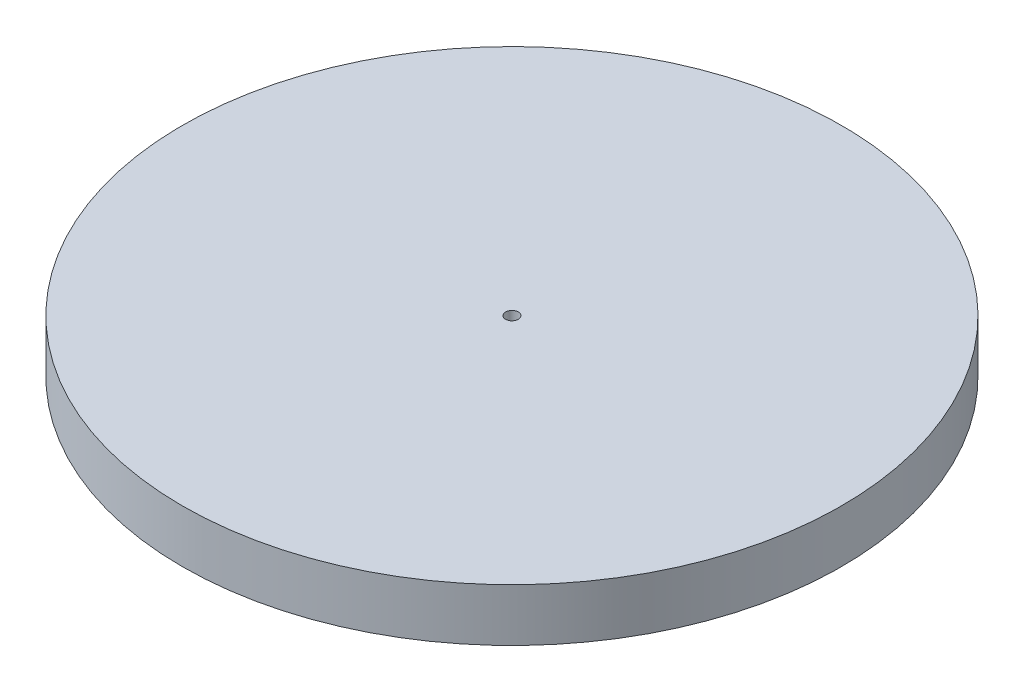
from build123d import *

# Parameters (mm, degrees)
SKETCH5_R          = 1.2
CUT_EXTRUDE1_DEPTH = 97.374391836


with BuildPart() as part:
    # Sketch3 → Revolve4 (revolve)
    with BuildSketch(Plane.XY, mode=Mode.PRIVATE) as revolve4_sk:
        with BuildLine():
            Line((1.2, 40), (1.2, 35))
            Line((1.2, 35), (0, 35))
            Line((0, 35), (0, 0))
            add(Edge.make_bspline(
                [(0, 0), (0.016019319, -0.000318055), (0.047363957, -0.000435511), (0.124565155, 0.000266609), (0.188009448, 0.004784889), (0.302162397, 0.014312965), (0.434906427, 0.033705318), (0.591621889, 0.064644454), (0.758367433, 0.108988084), (0.948542262, 0.167874068), (1.148421918, 0.240807637), (1.371995113, 0.333716386), (1.616332852, 0.447951628), (1.849490673, 0.566207637), (2.087888718, 0.695473704), (2.332059128, 0.835246826), (2.58184161, 0.985088882), (2.837525433, 1.144500635), (3.280910816, 1.429940425), (3.987203031, 1.90885241), (4.782895287, 2.47902437), (5.670177955, 3.135768142), (6.952119682, 4.102593634), (8.54259141, 5.325845847), (10.604195933, 6.925596943), (12.826583422, 8.642993281), (14.739325068, 10.108026887), (16.656080522, 11.562834877), (18.263641211, 12.770152933), (19.86943126, 13.963247261), (21.49455733, 15.156400303), (22.779497329, 16.09234009), (24.104955514, 17.047574491), (25.371752363, 17.954092797), (27.088904748, 19.168461977), (28.252901787, 19.98540612), (29.449304391, 20.812459503), (30, 21.192600657)],
                knots=[0.083228293, 0.083228293, 0.083228293, 0.083228293, 0.083228293, 0.084966808, 0.086705324, 0.088443839, 0.090182354, 0.094715982, 0.099249609, 0.102595877, 0.105942145, 0.11263468, 0.118542035, 0.12444939, 0.130356745, 0.1362641, 0.143077266, 0.149890431, 0.156703596, 0.163516762, 0.190769423, 0.227072871, 0.245224595, 0.263376319, 0.335983216, 0.408590105, 0.481196988, 0.517500433, 0.553803878, 0.62641076, 0.662714204, 0.699017649, 0.73532109, 0.77162453, 0.807927974, 0.844231418, 0.916838297, 0.916838297, 0.916838297, 0.916838297, 0.916838297], degree=4))
            Line((30, 21.192600657), (30, 22.192600657))
            Line((30, 22.192600657), (32, 22.192600657))
            add(Edge.make_bspline(
                [(32, 22.192600657), (32.162915702, 22.232666844), (32.488958654, 22.313115116), (33.263212157, 22.504689633), (33.899427502, 22.664143218), (34.764531294, 22.881239955), (35.599919047, 23.093016172), (36.60770971, 23.349566353), (37.666018765, 23.621449645), (38.842336337, 23.925372583), (40.008709056, 24.228933497), (41.277930329, 24.560859252), (42.855461777, 24.975889041), (44.685765864, 25.460096251), (46.877858703, 26.043480312), (49.138952662, 26.647832786), (51.578771091, 27.301669511), (53.733375607, 27.880212163), (56.351738039, 28.582694255), (58.206860039, 29.080808988), (60.542454551, 29.705648226), (61.51372473, 29.965262734), (62, 30.095100636)],
                knots=[0.083003414, 0.083003414, 0.083003414, 0.083003414, 0.083003414, 0.104634508, 0.126265607, 0.147896704, 0.1695278, 0.191650914, 0.224097561, 0.256544207, 0.288990852, 0.3214375, 0.353884145, 0.398191873, 0.463085165, 0.527978458, 0.59287175, 0.657765042, 0.722658334, 0.787551626, 0.852444918, 0.91733821, 0.91733821, 0.91733821, 0.91733821, 0.91733821], degree=4))
            Line((62, 30.095100636), (62, 40))
            Line((62, 40), (1.2, 40))
        make_face()
    revolve(revolve4_sk.sketch.rotate(Axis((0, 40, 0), (0, -1, 0)), 90), axis=Axis((0, 40, 0), (0, -1, 0)))

    # Sketch5 → Cut-Extrude1 (cut, through all)
    with BuildSketch(Plane(origin=(0, 40, 0), x_dir=(1, 0, 0), z_dir=(0, 1, 0))):
        with Locations(Location((0, 0, 0), (0, 0, 270))):
            Circle(SKETCH5_R)
    extrude(amount=-CUT_EXTRUDE1_DEPTH, mode=Mode.SUBTRACT)


solid = part.part
